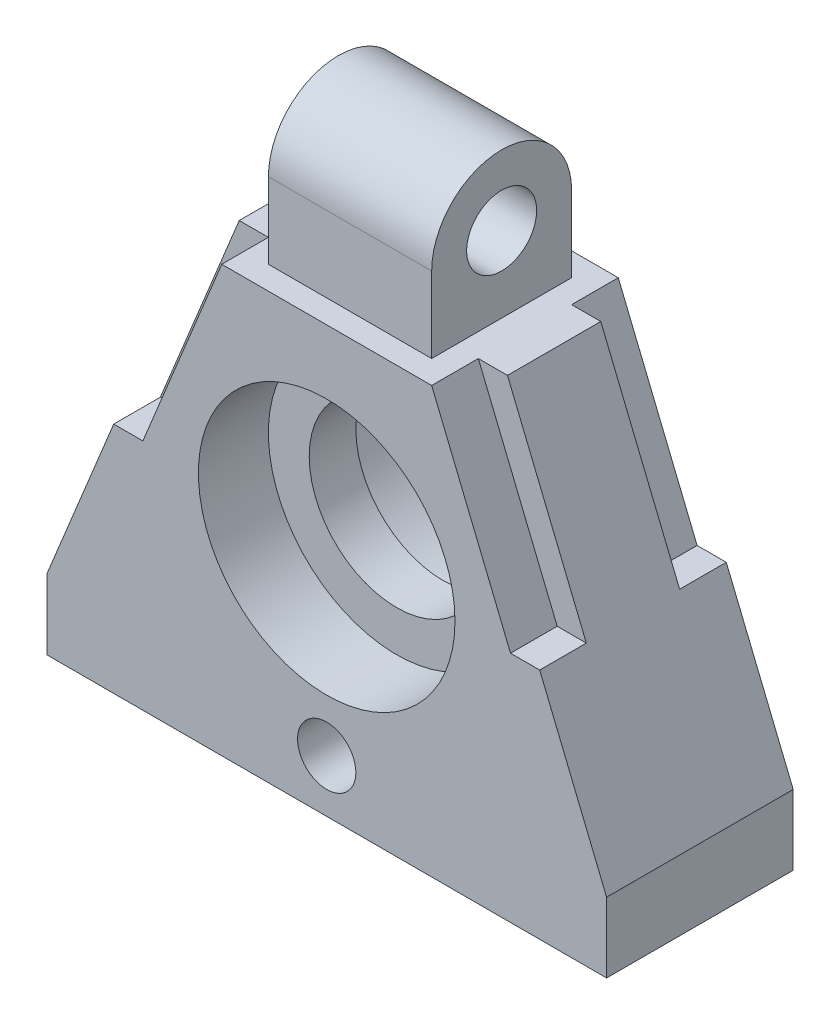
from build123d import *

# Parameters (mm, degrees)
CROQUIS1_R              = 15
CROQUIS1_R_2            = 5
SALIENTE_EXTRUIR1_DEPTH = 16
CORTAR_EXTRUIR1_START   = -12
CROQUIS2_R              = 22
CROQUIS2_R_2            = 15
CORTAR_EXTRUIR1_DEPTH   = 12
CORTAR_EXTRUIR2_DEPTH   = 8
CROQUIS4_R              = 6
SALIENTE_EXTRUIR2_DEPTH = 14


with BuildPart() as part:
    # Croquis1 → Saliente-Extruir1 (new, symmetric)
    with BuildSketch(Plane.XY):
        Polygon((-23, 73), (23, 73), (48, 12), (48, 0), (-48, 0), (-48, 12), align=None)
        with Locations((0, 40)):
            Circle(CROQUIS1_R, mode=Mode.SUBTRACT)
        with Locations((0, 9)):
            Circle(CROQUIS1_R_2, mode=Mode.SUBTRACT)
    extrude(amount=SALIENTE_EXTRUIR1_DEPTH, both=True)

    # Croquis2 → Cortar-Extruir1 (cut)
    with BuildSketch(Plane.XY.offset(16).offset(CORTAR_EXTRUIR1_START)):
        with Locations((0, 40)):
            Circle(CROQUIS2_R)
        with Locations((0, 40)):
            Circle(CROQUIS2_R_2, mode=Mode.SUBTRACT)
    cortar_extruir1 = extrude(amount=CORTAR_EXTRUIR1_DEPTH, mode=Mode.SUBTRACT)

    # Croquis3 → Cortar-Extruir2 (cut)
    with BuildSketch(Plane.XY.offset(16)):
        Polygon((23, 73), (36.524590164, 40), (31.524590164, 40), (18, 73), align=None)
        Polygon((-18, 73), (-23, 73), (-36.524590164, 40), (-31.524590164, 40), align=None)
    cortar_extruir2 = extrude(amount=-CORTAR_EXTRUIR2_DEPTH, mode=Mode.SUBTRACT)

    # Simetría1: Cortar-Extruir1, Cortar-Extruir2 across plane
    add(cortar_extruir1.mirror(Plane.XY), mode=Mode.SUBTRACT)
    add(cortar_extruir2.mirror(Plane.XY), mode=Mode.SUBTRACT)

    # Croquis4 → Saliente-Extruir2 (add, symmetric)
    with BuildSketch(Plane(origin=(0, 0, 0), x_dir=(0, 0, -1), z_dir=(1, 0, 0))):
        with BuildLine():
            Line((-12, 73), (12, 73))
            Line((12, 73), (12, 86))
            ThreePointArc((12, 86), (0, 98), (-12, 86))
            Line((-12, 86), (-12, 73))
        make_face()
        with Locations((0, 86)):
            Circle(CROQUIS4_R, mode=Mode.SUBTRACT)
    extrude(amount=SALIENTE_EXTRUIR2_DEPTH, both=True)


solid = part.part
